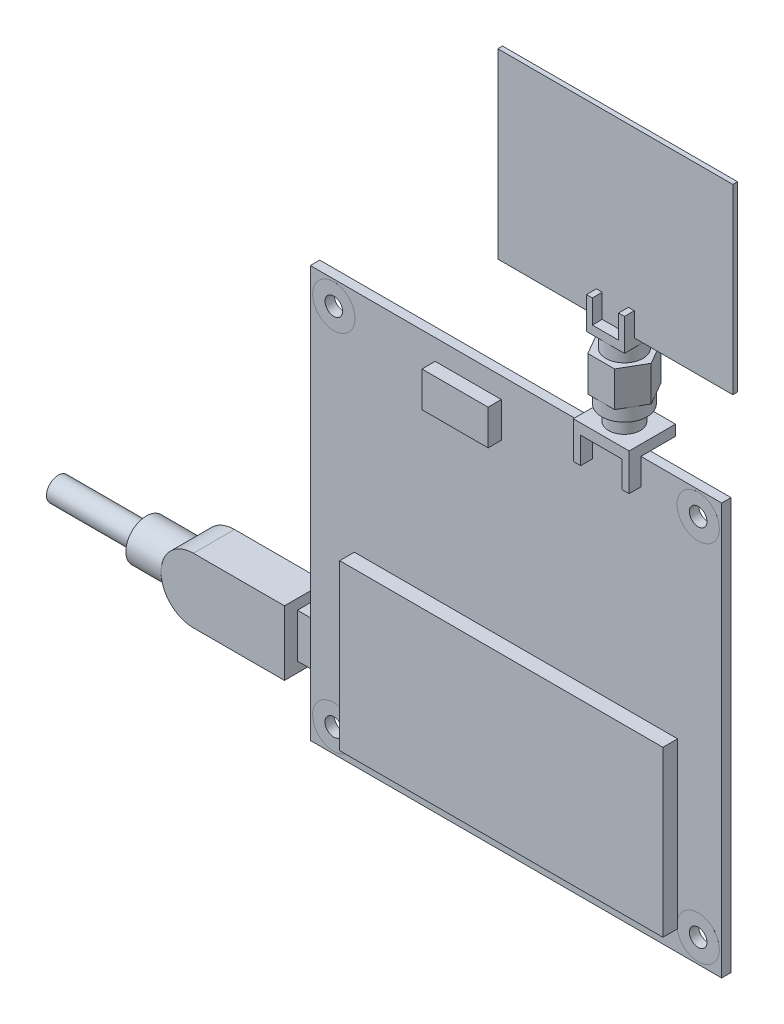
from build123d import *
from build123d.topology import SkipClean

# Parameters (mm, degrees)
SKETCH1_W                     = 70
SKETCH1_H                     = 70
GREEN_PCB_DEPTH               = 0.8
SKETCH2_R                     = 1.5
MOUNTING_HOLES_DEPTH          = 100.007878474
SCREW_GROUNDS_DEPTH           = 0.801
SCREW_GROUNDS_DEPTH_BACK      = 0.801
SKETCH3_R                     = 3.6
SKETCH3_R_2                   = 1.5
SKETCH4_W                     = 9.5
SKETCH4_H                     = 7.9
ANTENNA1_DEPTH                = 1.8
SKETCH10_W                    = 1.25
SKETCH10_H                    = 4.5
ANTENNA2_DEPTH                = 2
SKETCH5_R                     = 2.7
ANTENNA3_DEPTH                = 2.6
SKETCH6_R                     = 3.85
ANTENNA4_DEPTH                = 2.25
ANTENNA5_DEPTH                = 6
SKETCH8_R                     = 3.15
ANTENNA6_DEPTH                = 2.4
SKETCH9_W                     = 6.45
SKETCH9_H                     = 6.45
ANTENNA7_DEPTH                = 1.45
SKETCH11_W                    = 40
SKETCH11_H                    = 0.8
ANTENNA_PCB_DEPTH             = 31
SKETCH19_W                    = 1
SKETCH19_H                    = 4
ANTENNA8_DEPTH                = 1.675
SKETCH12_W                    = 55
SKETCH12_H                    = 28
LCD_DEPTH                     = 2.5
SKETCH13_W                    = 11.25
SKETCH13_H                    = 6
OPTION_SWITCH_DEPTH           = 2.25
SKETCH14_W                    = 7.8
SKETCH14_H                    = 7.5
USB_PORT_DEPTH                = 2.6
USB_BODY_DEPTH                = 3.5
USB_TENSION_RELIEF_DEPTH      = 6
USB_TENSION_RELIEF_DEPTH_BACK = 6
SKETCH17_R                    = 3.5
SKETCH18_R                    = 2
USB_CORD_DEPTH                = 15


with BuildPart() as part:
    # Sketch1 → Green PCB (new, symmetric)
    with BuildSketch(Plane.XY):
        with Locations((35, 35)):
            Rectangle(SKETCH1_W, SKETCH1_H)
    extrude(amount=GREEN_PCB_DEPTH, both=True)

    # Sketch2 → Mounting Holes (cut, through all)
    with BuildSketch(Plane.XY.offset(0.8)):
        with Locations((4, 4)):
            Circle(SKETCH2_R)
        with Locations((66, 4)):
            Circle(SKETCH2_R)
        with Locations((66, 66)):
            Circle(SKETCH2_R)
        with Locations((4, 66)):
            Circle(SKETCH2_R)
    extrude(amount=-MOUNTING_HOLES_DEPTH, mode=Mode.SUBTRACT)

    # Sketch3 → Screw Grounds (add, two sides: drawn at the far end of the back side and taken through both)
    # profile 1 of 4: a face of its own
    with BuildSketch(Plane.XY.offset(-SCREW_GROUNDS_DEPTH_BACK)):
        with Locations(Location((4, 66, 0), (0, 0, 180))):
            Circle(SKETCH3_R)
        with Locations(Location((4, 66, 0), (0, 0, 180))):
            Circle(SKETCH3_R_2, mode=Mode.SUBTRACT)
    # profile 2 of 4: a face of its own
    with BuildSketch(Plane.XY.offset(-SCREW_GROUNDS_DEPTH_BACK)):
        with Locations(Location((66, 66, 0), (0, 0, 180))):
            Circle(SKETCH3_R)
        with Locations(Location((66, 66, 0), (0, 0, 180))):
            Circle(SKETCH3_R_2, mode=Mode.SUBTRACT)
    # profile 3 of 4: a face of its own
    with BuildSketch(Plane.XY.offset(-SCREW_GROUNDS_DEPTH_BACK)):
        with Locations(Location((66, 4, 0), (0, 0, 180))):
            Circle(SKETCH3_R)
        with Locations(Location((66, 4, 0), (0, 0, 180))):
            Circle(SKETCH3_R_2, mode=Mode.SUBTRACT)
    # profile 4 of 4: a face of its own
    with BuildSketch(Plane.XY.offset(-SCREW_GROUNDS_DEPTH_BACK)):
        with Locations(Location((4, 4, 0), (0, 0, 180))):
            Circle(SKETCH3_R)
        with Locations(Location((4, 4, 0), (0, 0, 180))):
            Circle(SKETCH3_R_2, mode=Mode.SUBTRACT)
    extrude(amount=SCREW_GROUNDS_DEPTH + SCREW_GROUNDS_DEPTH_BACK)

    # Sketch4 → Antenna1 (add)
    with BuildSketch(Plane(origin=(0, 70, 0), x_dir=(1, 0, 0), z_dir=(0, 1, 0))):
        with Locations((51.5, 1.15)):
            Rectangle(SKETCH4_W, SKETCH4_H)
    extrude(amount=ANTENNA1_DEPTH)

    # Sketch10 → Antenna2 (add)
    with BuildSketch(Plane.XY.offset(2.8)):
        with Locations((47.375, 67.75)):
            Rectangle(SKETCH10_W, SKETCH10_H)
        with Locations((55.625, 67.75)):
            Rectangle(SKETCH10_W, SKETCH10_H)
    extrude(amount=-ANTENNA2_DEPTH)

    # Sketch5 → Antenna3 (add)
    with BuildSketch(Plane(origin=(0, 71.8, 0), x_dir=(1, 0, 0), z_dir=(0, 1, 0))):
        with Locations(Location((51.5, 1.15, 0), (0, 0, 270))):
            Circle(SKETCH5_R)
    extrude(amount=ANTENNA3_DEPTH)

    # Sketch6 → Antenna4 (add)
    with SkipClean():  # the faces are left unmerged after this step: merging them gives an invalid solid
        with BuildSketch(Plane(origin=(0, 74.4, 0), x_dir=(1, 0, 0), z_dir=(0, 1, 0))):
            with Locations(Location((51.5, 1.15, 0), (0, 0, 270))):
                Circle(SKETCH6_R)
        extrude(amount=ANTENNA4_DEPTH)

    # Sketch7 → Antenna5 (add)
    with SkipClean():  # the faces are left unmerged after this step: merging them gives an invalid solid
        with BuildSketch(Plane(origin=(0, 76.65, 0), x_dir=(1, 0, 0), z_dir=(0, 1, 0))):
            Polygon((49.219466437, -2.8), (53.780533563, -2.8), (56.061067127, 1.15), (53.780533563, 5.1), (49.219466437, 5.1), (46.938932873, 1.15), align=None)
        extrude(amount=ANTENNA5_DEPTH)

    # Sketch8 → Antenna6 (add)
    with SkipClean():  # the faces are left unmerged after this step: merging them gives an invalid solid
        with BuildSketch(Plane(origin=(0, 82.65, 0), x_dir=(1, 0, 0), z_dir=(0, 1, 0))):
            with Locations(Location((51.5, 1.15, 0), (0, 0, 270))):
                Circle(SKETCH8_R)
        extrude(amount=ANTENNA6_DEPTH)

    # Sketch9 → Antenna7 (add)
    with SkipClean():  # the faces are left unmerged after this step: merging them gives an invalid solid
        with BuildSketch(Plane(origin=(0, 85.05, 0), x_dir=(1, 0, 0), z_dir=(0, 1, 0))):
            with Locations((51.5, 1.15)):
                Rectangle(SKETCH9_W, SKETCH9_H)
        extrude(amount=ANTENNA7_DEPTH)

    # Sketch11 → Antenna PCB (add)
    with SkipClean():  # the faces are left unmerged after this step: merging them gives an invalid solid
        with BuildSketch(Plane(origin=(0, 86.5, 0), x_dir=(1, 0, 0), z_dir=(0, 1, 0))):
            with Locations((51.5, 0)):
                Rectangle(SKETCH11_W, SKETCH11_H)
        extrude(amount=ANTENNA_PCB_DEPTH)

    # Sketch19 → Antenna8 (add)
    with SkipClean():  # the faces are left unmerged after this step: merging them gives an invalid solid
        with BuildSketch(Plane.XY.offset(2.075)):
            with Locations((48.775, 88.5)):
                Rectangle(SKETCH19_W, SKETCH19_H)
            with Locations((54.225, 88.5)):
                Rectangle(SKETCH19_W, SKETCH19_H)
        extrude(amount=-ANTENNA8_DEPTH)

    # Sketch12 → LCD (add)
    with SkipClean():  # the faces are left unmerged after this step: merging them gives an invalid solid
        with BuildSketch(Plane.XY.offset(0.8)):
            with Locations((35, 17.5)):
                Rectangle(SKETCH12_W, SKETCH12_H)
        extrude(amount=LCD_DEPTH)

    # Sketch13 → Option Switch (add)
    with SkipClean():  # the faces are left unmerged after this step: merging them gives an invalid solid
        with BuildSketch(Plane.XY.offset(0.8)):
            with Locations((26.875, 63.5)):
                Rectangle(SKETCH13_W, SKETCH13_H)
        extrude(amount=OPTION_SWITCH_DEPTH)

    # Sketch14 → USB Port (add)
    with SkipClean():  # the faces are left unmerged after this step: merging them gives an invalid solid
        with BuildSketch(Plane(origin=(0, 0, -0.8), x_dir=(-1, 0, 0), z_dir=(0, 0, -1))):
            with Locations((-0.1, 12.75)):
                Rectangle(SKETCH14_W, SKETCH14_H)
        extrude(amount=USB_PORT_DEPTH)

    # Sketch16 → USB Body (add, symmetric)
    with BuildSketch(Plane(origin=(0, 0, -2.1), x_dir=(-1, 0, 0), z_dir=(0, 0, -1))):
        with BuildLine():
            Line((19.3, 7.25), (3.8, 7.25))
            Line((3.8, 7.25), (3.8, 18.25))
            Line((3.8, 18.25), (19.3, 18.25))
            ThreePointArc((19.3, 18.25), (24.8, 12.75), (19.3, 7.25))
        make_face()
    extrude(amount=USB_BODY_DEPTH, both=True)

    # Sketch17 → USB Tension Relief (add, two sides: drawn at the far end of the back side and taken through both)
    with BuildSketch(Plane.ZY.offset(24.8).offset(-USB_TENSION_RELIEF_DEPTH_BACK)):
        with Locations((-2.1, 12.75)):
            Circle(SKETCH17_R)
    extrude(amount=USB_TENSION_RELIEF_DEPTH + USB_TENSION_RELIEF_DEPTH_BACK)

    # Sketch18 → USB Cord (add)
    with BuildSketch(Plane.ZY.offset(30.8)):
        with Locations((-2.1, 12.75)):
            Circle(SKETCH18_R)
    extrude(amount=USB_CORD_DEPTH)


solid = part.part
